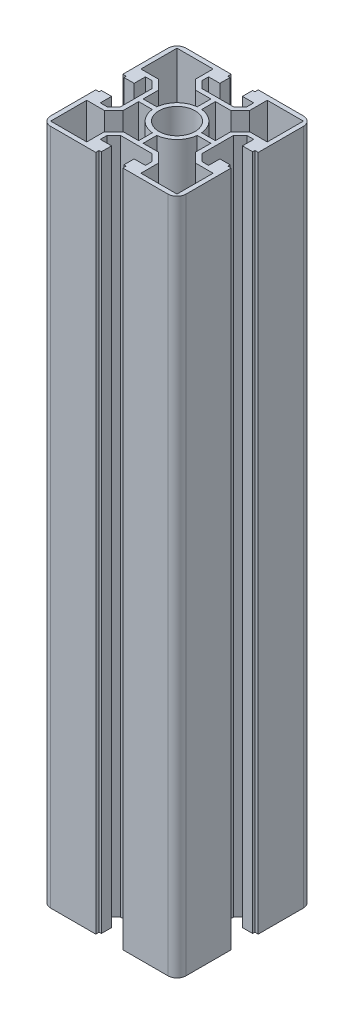
from build123d import *

# Parameters (mm, degrees)
SKETCH_1_R      = 8
EXTRUDE_1_DEPTH = 300


with BuildPart() as part:
    # 草图1 → 凸台-拉伸1 (new body)
    with BuildSketch(Plane(origin=(0, 0, 0), x_dir=(1, 0, 0), z_dir=(0, 1, 0))):
        with BuildLine():
            Line((-30, 5.999999999), (-28.5, 5.999999999))
            Line((-28.5, 5.999999999), (-28.5, 4.999999999))
            Line((-28.5, 4.999999999), (-24, 4.999999999))
            Line((-24, 4.999999999), (-24, 9.999999999))
            Line((-24, 9.999999999), (-21, 9.999999999))
            Line((-21, 9.999999999), (-18, 6.999999999))
            Line((-18, 6.999999999), (-18, -7.000000001))
            Line((-18, -7.000000001), (-21, -10.000000001))
            Line((-21, -10.000000001), (-24, -10.000000001))
            Line((-24, -10.000000001), (-24, -5.000000001))
            Line((-24, -5.000000001), (-28.5, -5.000000001))
            Line((-28.5, -5.000000001), (-28.5, -6.000000001))
            Line((-28.5, -6.000000001), (-30, -6.000000001))
            Line((-30, -6.000000001), (-30, -26.000000001))
            ThreePointArc((-30, -26.000000001), (-28.828427125, -28.828427126), (-26, -30.000000001))
            Line((-26, -30.000000001), (-6, -30.000000001))
            Line((-6, -30.000000001), (-6, -28.500000001))
            Line((-6, -28.500000001), (-5, -28.500000001))
            Line((-5, -28.500000001), (-5, -24.000000001))
            Line((-5, -24.000000001), (-10, -24.000000001))
            Line((-10, -24.000000001), (-10, -21.000000001))
            Line((-10, -21.000000001), (-7, -18.000000001))
            Line((-7, -18.000000001), (7, -18.000000001))
            Line((7, -18.000000001), (10, -21.000000001))
            Line((10, -21.000000001), (10, -24.000000001))
            Line((10, -24.000000001), (5, -24.000000001))
            Line((5, -24.000000001), (5, -28.500000001))
            Line((5, -28.500000001), (6, -28.500000001))
            Line((6, -28.500000001), (6, -30.000000001))
            Line((6, -30.000000001), (26, -30.000000001))
            ThreePointArc((26, -30.000000001), (28.828427125, -28.828427126), (30, -26.000000001))
            Line((30, -26.000000001), (30, -6.000000001))
            Line((30, -6.000000001), (28.5, -6.000000001))
            Line((28.5, -6.000000001), (28.5, -5.000000001))
            Line((28.5, -5.000000001), (24, -5.000000001))
            Line((24, -5.000000001), (24, -10.000000001))
            Line((24, -10.000000001), (21, -10.000000001))
            Line((21, -10.000000001), (18, -7.000000001))
            Line((18, -7.000000001), (18, 6.999999999))
            Line((18, 6.999999999), (21, 9.999999999))
            Line((21, 9.999999999), (24, 9.999999999))
            Line((24, 9.999999999), (24, 4.999999999))
            Line((24, 4.999999999), (28.5, 4.999999999))
            Line((28.5, 4.999999999), (28.5, 5.999999999))
            Line((28.5, 5.999999999), (30, 5.999999999))
            Line((30, 5.999999999), (30, 25.999999999))
            ThreePointArc((30, 25.999999999), (28.828427125, 28.828427124), (26, 29.999999999))
            Line((26, 29.999999999), (6, 29.999999999))
            Line((6, 29.999999999), (6, 28.499999999))
            Line((6, 28.499999999), (5, 28.499999999))
            Line((5, 28.499999999), (5, 23.999999999))
            Line((5, 23.999999999), (10, 23.999999999))
            Line((10, 23.999999999), (10, 20.999999999))
            Line((10, 20.999999999), (7, 17.999999999))
            Line((7, 17.999999999), (-7, 17.999999999))
            Line((-7, 17.999999999), (-10, 20.999999999))
            Line((-10, 20.999999999), (-10, 23.999999999))
            Line((-10, 23.999999999), (-5, 23.999999999))
            Line((-5, 23.999999999), (-5, 28.499999999))
            Line((-5, 28.499999999), (-6, 28.499999999))
            Line((-6, 28.499999999), (-6, 29.999999999))
            Line((-6, 29.999999999), (-26.000000001, 29.999999999))
            ThreePointArc((-26.000000001, 29.999999999), (-28.828427125, 28.828427123), (-30, 25.999999999))
            Line((-30, 25.999999999), (-30, 5.999999999))
        make_face()
        with Locations(Location((0, 0, 0), (0, 0, 270))):
            Circle(SKETCH_1_R, mode=Mode.SUBTRACT)
        with BuildLine():
            Line((-16, 1), (-9.949874371, 1))
            ThreePointArc((-9.949874371, 1), (-7.071067812, 7.071067811), (-1.000000001, 9.949874371))
            Line((-1.000000001, 9.949874371), (-1.000000001, 16))
            Line((-1.000000001, 16), (-7.828427125, 16))
            Line((-7.828427125, 16), (-12, 20.171572875))
            Line((-12, 20.171572875), (-12, 28))
            Line((-12, 28), (-28, 28))
            Line((-28, 28), (-28, 12))
            Line((-28, 12), (-20.171572875, 12))
            Line((-20.171572875, 12), (-16, 7.828427125))
            Line((-16, 7.828427125), (-16, 1))
        make_face(mode=Mode.SUBTRACT)
        with BuildLine():
            Line((1, 9.949874371), (1, 16))
            Line((1, 16), (7.828427125, 16))
            Line((7.828427125, 16), (12, 20.171572875))
            Line((12, 20.171572875), (12, 28))
            Line((12, 28), (28, 28))
            Line((28, 28), (28, 12.000000001))
            Line((28, 12.000000001), (20.171572875, 12.000000001))
            Line((20.171572875, 12.000000001), (16, 7.828427126))
            Line((16, 7.828427126), (16, 1.000000001))
            Line((16, 1.000000001), (9.949874371, 1.000000001))
            ThreePointArc((9.949874371, 1.000000001), (7.071067811, 7.071067812), (1, 9.949874371))
        make_face(mode=Mode.SUBTRACT)
        with BuildLine():
            Line((9.949874371, -1), (16, -1))
            Line((16, -1), (16, -7.828427125))
            Line((16, -7.828427125), (20.171572875, -12))
            Line((20.171572875, -12), (28.000000001, -12))
            Line((28.000000001, -12), (28.000000001, -28))
            Line((28.000000001, -28), (12.000000001, -28))
            Line((12.000000001, -28), (12.000000001, -20.171572875))
            Line((12.000000001, -20.171572875), (7.828427126, -16))
            Line((7.828427126, -16), (1.000000001, -16))
            Line((1.000000001, -16), (1.000000001, -9.949874371))
            ThreePointArc((1.000000001, -9.949874371), (7.071067812, -7.071067811), (9.949874371, -1))
        make_face(mode=Mode.SUBTRACT)
        with BuildLine():
            Line((-1, -9.949874371), (-1, -16.000000001))
            Line((-1, -16.000000001), (-7.828427125, -16.000000001))
            Line((-7.828427125, -16.000000001), (-12, -20.171572876))
            Line((-12, -20.171572876), (-12, -28.000000001))
            Line((-12, -28.000000001), (-28, -28.000000001))
            Line((-28, -28.000000001), (-28, -12.000000001))
            Line((-28, -12.000000001), (-20.171572875, -12.000000001))
            Line((-20.171572875, -12.000000001), (-16, -7.828427126))
            Line((-16, -7.828427126), (-16, -1.000000001))
            Line((-16, -1.000000001), (-9.949874371, -1.000000001))
            ThreePointArc((-9.949874371, -1.000000001), (-7.071067811, -7.071067812), (-1, -9.949874371))
        make_face(mode=Mode.SUBTRACT)
    extrude(amount=EXTRUDE_1_DEPTH)


solid = part.part
